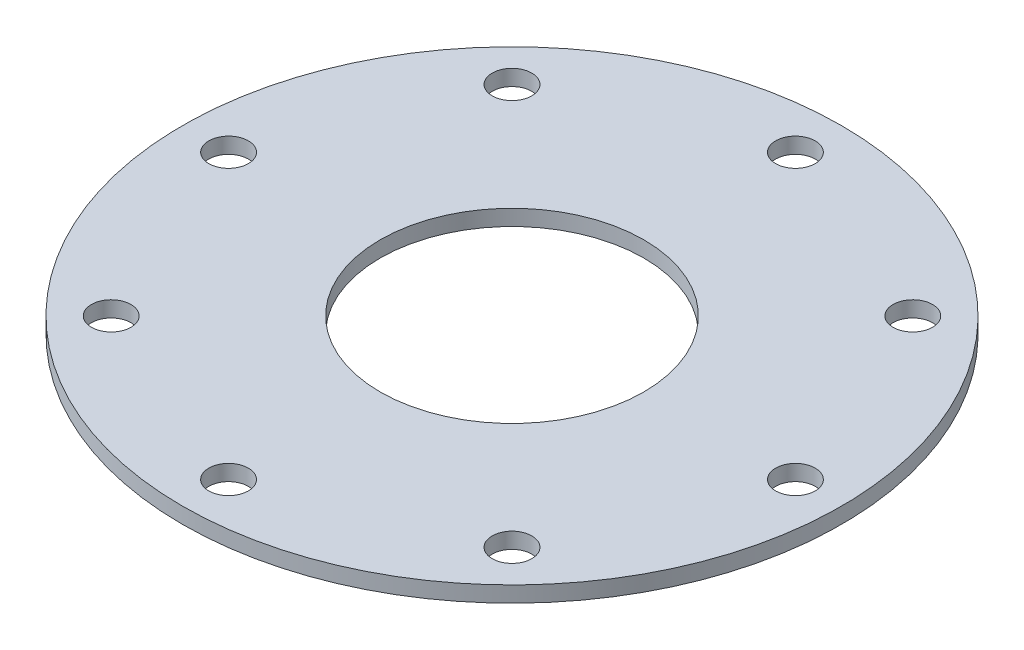
from build123d import *

# Parameters (mm, degrees)
SKETCH1_R           = 125
BOSS_EXTRUDE1_DEPTH = 6
SKETCH2_R           = 50
CUT_EXTRUDE1_DEPTH  = 6
SKETCH3_R           = 7.5
CUT_EXTRUDE2_DEPTH  = 6
CIRPATTERN1_COUNT   = 8


with BuildPart() as part:
    # Sketch1 → Boss-Extrude1 (new body)
    with BuildSketch(Plane(origin=(0, 0, 0), x_dir=(1, 0, 0), z_dir=(0, 1, 0))):
        with Locations(Location((0, 0, 0), (0, 0, 270))):
            Circle(SKETCH1_R)
    extrude(amount=BOSS_EXTRUDE1_DEPTH)

    # Sketch2 → Cut-Extrude1 (cut)
    with BuildSketch(Plane(origin=(0, 6, 0), x_dir=(1, 0, 0), z_dir=(0, 1, 0))):
        with Locations(Location((0, 0, 0), (0, 0, 270))):
            Circle(SKETCH2_R)
    extrude(amount=-CUT_EXTRUDE1_DEPTH, mode=Mode.SUBTRACT)

    # Sketch3 → Cut-Extrude2 (cut)
    with BuildSketch(Plane(origin=(0, 6, 0), x_dir=(1, 0, 0), z_dir=(0, 1, 0))):
        with Locations(Location((0, 107.5, 0), (0, 0, 270))):
            Circle(SKETCH3_R)
    cut_extrude2 = extrude(amount=-CUT_EXTRUDE2_DEPTH, mode=Mode.SUBTRACT)

    # CirPattern1: Cut-Extrude2 ×8 about axis
    cirpattern1_axis = Axis((0, 0, 0), (0, 1, 0))
    for i in range(1, CIRPATTERN1_COUNT):
        add(cut_extrude2.rotate(cirpattern1_axis, i * 360 / CIRPATTERN1_COUNT), mode=Mode.SUBTRACT)


solid = part.part
